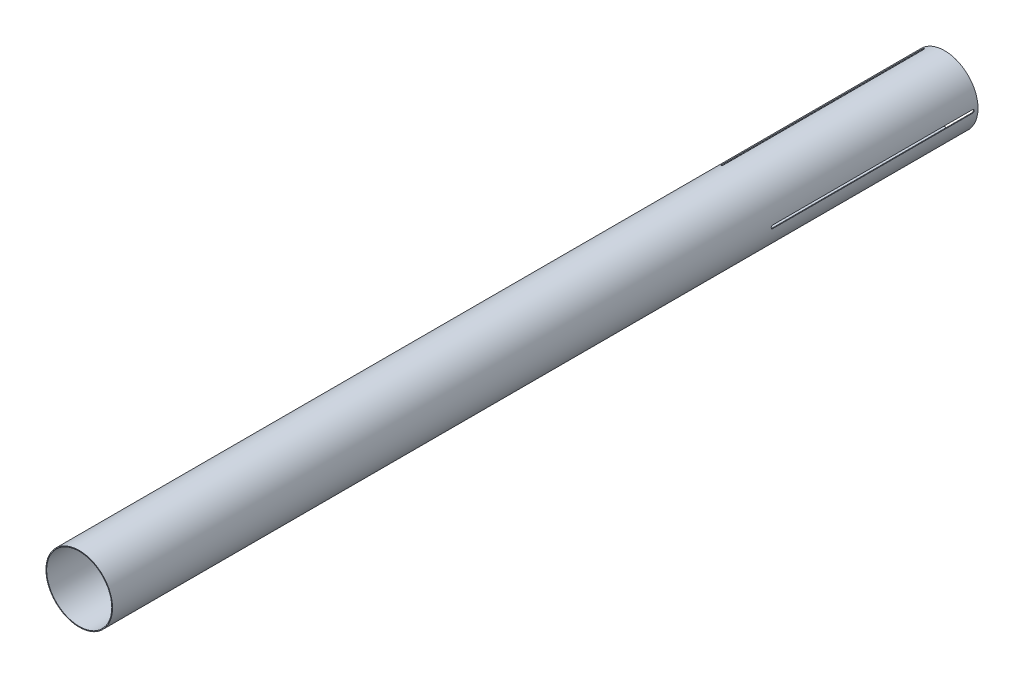
from build123d import *

# Parameters (mm, degrees)
SKETCH1_R               = 50.8
SKETCH1_R_2             = 49.6697
BOSS_EXTRUDE1_DEPTH     = 1320.8
CUT_EXTRUDE1_REACH      = 1327.676
CUT_EXTRUDE1_END_RADIUS = 49.6697
CIRPATTERN1_COUNT       = 3


with BuildPart() as part:
    # Sketch1 → Boss-Extrude1 (new body)
    with BuildSketch(Plane.XY):
        Circle(SKETCH1_R)
        Circle(SKETCH1_R_2, mode=Mode.SUBTRACT)
    extrude(amount=BOSS_EXTRUDE1_DEPTH)

    # Cut-Extrude1: up to this cylinder (the profile starts outside it)
    cut_extrude1_end = Plane(origin=(0, 0, 160.782), z_dir=(0, 0, -1)) * Cylinder(CUT_EXTRUDE1_END_RADIUS, 2755.6914, mode=Mode.PRIVATE)
    # Sketch2 → Cut-Extrude1 (cut, up to the surface)
    with BuildSketch(Plane(origin=(50.8, 0, 0), x_dir=(0, 0, -1), z_dir=(1, 0, 0)), mode=Mode.PRIVATE) as cut_extrude1_sk1:
        with BuildLine():
            Line((-8.382, -2.38125), (-313.182, -2.38125))
            ThreePointArc((-313.182, -2.38125), (-315.56325, 0), (-313.182, 2.38125))
            Line((-313.182, 2.38125), (-8.382, 2.38125))
            ThreePointArc((-8.382, 2.38125), (-6.00075, 0), (-8.382, -2.38125))
        make_face()
    cut_extrude1_tool1 = extrude(cut_extrude1_sk1.sketch, amount=-CUT_EXTRUDE1_REACH, mode=Mode.PRIVATE) - cut_extrude1_end
    cut_extrude1 = cut_extrude1_tool1.solids().sort_by_distance((50.8, 0, 160.782))[0]
    add(cut_extrude1, mode=Mode.SUBTRACT)

    # CirPattern1: Cut-Extrude1 ×3 about axis
    cirpattern1_axis = Axis((0, 0, 0), (0, 0, 1))
    for i in range(1, CIRPATTERN1_COUNT):
        add(cut_extrude1.rotate(cirpattern1_axis, i * 360 / CIRPATTERN1_COUNT), mode=Mode.SUBTRACT)


solid = part.part
